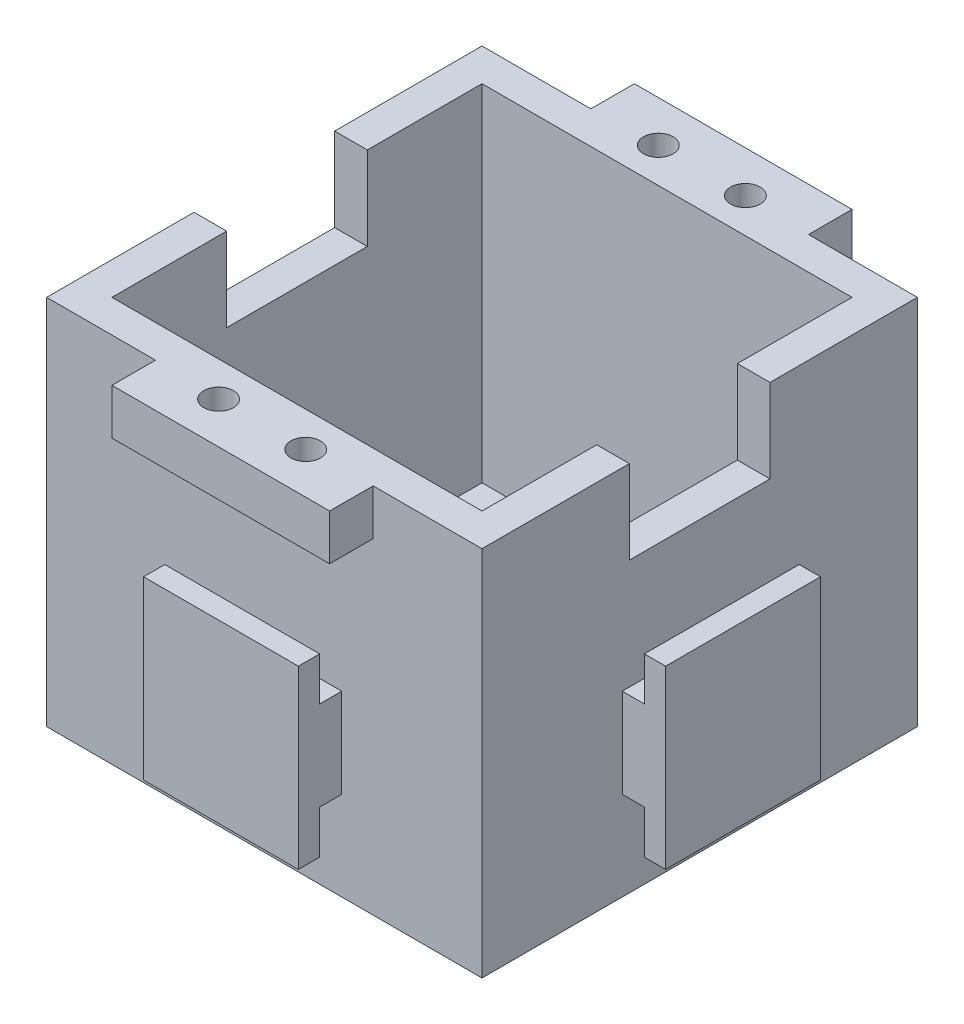
from build123d import *

# Parameters (mm, degrees)
SKETCH1_W                                    = 50
SKETCH1_H                                    = 50
BOSS_EXTRUDE1_DEPTH                          = 3
SKETCH3_W                                    = 50
SKETCH3_H                                    = 50
SKETCH3_W_2                                  = 42.5
SKETCH3_H_2                                  = 42.5
BOSS_EXTRUDE2_DEPTH                          = 39.7
CUT_EXTRUDE5_START                           = -5
SKETCH19_W                                   = 16.15
SKETCH19_H                                   = 9.6
CUT_EXTRUDE5_DEPTH                           = 76.344082907
SKETCH33_W                                   = 25
SKETCH33_H                                   = 5.25
BOSS_EXTRUDE14_DEPTH                         = 5
SKETCH21_R                                   = 1.7
CUT_EXTRUDE6_DEPTH                           = 5
CUT_EXTRUDE8_REACH                           = 59.864
SKETCH27_R                                   = 11.5
CSK_FOR_M3_COUNTERSUNK_FLAT_HEAD_SCR_2_COUNT = 2
CSK_FOR_M3_COUNTERSUNK_FLAT_HEAD_SCR_2_PITCH = 31
CSK_FOR_M3_COUNTERSUNK_FLAT_HEAD_SCR_3_COUNT = 2
CSK_FOR_M3_COUNTERSUNK_FLAT_HEAD_SCR_3_PITCH = 43.840620434
CSK_FOR_M3_COUNTERSUNK_FLAT_HEAD_SCR_4_COUNT = 2
CSK_FOR_M3_COUNTERSUNK_FLAT_HEAD_SCR_4_PITCH = 31
SKETCH34_W                                   = 17.78
SKETCH34_H                                   = 10.2616
BOSS_EXTRUDE15_DEPTH                         = 4.9784
SKETCH35_W                                   = 17.78
SKETCH35_H                                   = 2.4384
BOSS_EXTRUDE16_DEPTH                         = 4.9784
CIRPATTERN1_COUNT                            = 4
CIRPATTERN1_COPY_1_SKETCH_W                  = 17.78
CIRPATTERN1_COPY_1_SKETCH_H                  = 2.4384
CIRPATTERN1_COPY_1_DEPTH                     = 4.9784
CIRPATTERN1_COPY_2_SKETCH_W                  = 17.78
CIRPATTERN1_COPY_2_SKETCH_H                  = 2.4384
CIRPATTERN1_COPY_2_DEPTH                     = 4.9784
CIRPATTERN1_COPY_3_SKETCH_W                  = 17.78
CIRPATTERN1_COPY_3_SKETCH_H                  = 2.4384
CIRPATTERN1_COPY_3_DEPTH                     = 4.9784


with BuildPart() as part:
    # Sketch1 → Boss-Extrude1 (new body)
    with BuildSketch(Plane(origin=(0, 0, 0), x_dir=(1, 0, 0), z_dir=(0, 1, 0))):
        Rectangle(SKETCH1_W, SKETCH1_H)
    extrude(amount=BOSS_EXTRUDE1_DEPTH)

    # Sketch3 → Boss-Extrude2 (add)
    with BuildSketch(Plane(origin=(0, 3, 0), x_dir=(1, 0, 0), z_dir=(0, 1, 0))):
        Rectangle(SKETCH3_W, SKETCH3_H)
        Rectangle(SKETCH3_W_2, SKETCH3_H_2, mode=Mode.SUBTRACT)
    extrude(amount=BOSS_EXTRUDE2_DEPTH)

    # Sketch19 → Cut-Extrude5 (cut)
    with BuildSketch(Plane(origin=(25, 0, 0), x_dir=(0, 0, -1), z_dir=(1, 0, 0)).offset(CUT_EXTRUDE5_START)):
        with Locations((0, 37.9)):
            Rectangle(SKETCH19_W, SKETCH19_H)
    cut_extrude5 = extrude(amount=CUT_EXTRUDE5_DEPTH, mode=Mode.SUBTRACT)

    # Sketch33 → Boss-Extrude14 (add)
    with BuildSketch(Plane.XY.offset(25)):
        with Locations((0, 40.075)):
            Rectangle(SKETCH33_W, SKETCH33_H)
    boss_extrude14 = extrude(amount=BOSS_EXTRUDE14_DEPTH)

    # Mirror7: Boss-Extrude14 across plane
    add(boss_extrude14.mirror(Plane.XY))

    # Sketch21 → Cut-Extrude6 (cut)
    with BuildSketch(Plane(origin=(0, 42.7, 0), x_dir=(1, 0, 0), z_dir=(0, 1, 0))):
        with Locations(Location((5, -25.25, 0), (0, 0, 270))):
            Circle(SKETCH21_R)
        with Locations(Location((-5, 25.25, 0), (0, 0, 270))):
            Circle(SKETCH21_R)
        with Locations(Location((5, 25.25, 0), (0, 0, 270))):
            Circle(SKETCH21_R)
        with Locations(Location((-5, -25.25, 0), (0, 0, 270))):
            Circle(SKETCH21_R)
    extrude(amount=-CUT_EXTRUDE6_DEPTH, mode=Mode.SUBTRACT)

    # Sketch27 → Cut-Extrude8 (cut, up to next)
    with BuildSketch(Plane.XZ, mode=Mode.PRIVATE) as cut_extrude8_sk1:
        with Locations(Location((0, 0, 0), (0, 0, 270))):
            Circle(SKETCH27_R)
    cut_extrude8_tool1 = extrude(cut_extrude8_sk1.sketch, amount=-CUT_EXTRUDE8_REACH, mode=Mode.PRIVATE) & part.part
    add(cut_extrude8_tool1.solids().sort_by_distance((0, 0, 0))[0], mode=Mode.SUBTRACT)

    # Sketch30 → CSK for M3 Countersunk Flat Head Screw1 (revolve, cut)
    with BuildSketch(Plane(origin=(-15.5, 0, 15.5), x_dir=(0, 0, -1), z_dir=(1, 0, 0))):
        Polygon((0, 0), (0, 3), (1.7, 3), (1.7, 1.45), (3.15, 0), align=None)
    csk_for_m3_countersunk_flat_head_screw1 = revolve(axis=Axis((-15.5, -6.35, 15.5), (0, 1, 0)), mode=Mode.SUBTRACT)

    # CSK for M3 Countersunk Flat Head Scr 2: CSK for M3 Countersunk Flat Head Screw1 ×2
    with Locations(*[(i * CSK_FOR_M3_COUNTERSUNK_FLAT_HEAD_SCR_2_PITCH, 0, 0) for i in range(1, CSK_FOR_M3_COUNTERSUNK_FLAT_HEAD_SCR_2_COUNT)]):
        add(csk_for_m3_countersunk_flat_head_screw1, mode=Mode.SUBTRACT)

    # CSK for M3 Countersunk Flat Head Scr 3: CSK for M3 Countersunk Flat Head Screw1 ×2
    with Locations(*[Vector(0.7071067811865475, 0, -0.7071067811865476) * (i * CSK_FOR_M3_COUNTERSUNK_FLAT_HEAD_SCR_3_PITCH) for i in range(1, CSK_FOR_M3_COUNTERSUNK_FLAT_HEAD_SCR_3_COUNT)]):
        add(csk_for_m3_countersunk_flat_head_screw1, mode=Mode.SUBTRACT)

    # CSK for M3 Countersunk Flat Head Scr 4: CSK for M3 Countersunk Flat Head Screw1 ×2
    with Locations(*[(0, 0, -i * CSK_FOR_M3_COUNTERSUNK_FLAT_HEAD_SCR_4_PITCH) for i in range(1, CSK_FOR_M3_COUNTERSUNK_FLAT_HEAD_SCR_4_COUNT)]):
        add(csk_for_m3_countersunk_flat_head_screw1, mode=Mode.SUBTRACT)

    # Mirror4: Cut-Extrude5 across plane
    add(cut_extrude5.mirror(Plane(origin=(0, 0, 0), x_dir=(0, 0, 1), z_dir=(1, 0, 0))), mode=Mode.SUBTRACT)

    # Sketch34 → Boss-Extrude15 (add)
    with BuildSketch(Plane.XY.offset(25)):
        with Locations((0, 15.3416)):
            Rectangle(SKETCH34_W, SKETCH34_H)
    boss_extrude15 = extrude(amount=BOSS_EXTRUDE15_DEPTH)

    # Sketch35 → Boss-Extrude16 (add)
    with BuildSketch(Plane(origin=(0, 20.4724, 0), x_dir=(1, 0, 0), z_dir=(0, 1, 0))):
        with Locations((0, -28.7592)):
            Rectangle(SKETCH35_W, SKETCH35_H)
    boss_extrude16 = extrude(amount=BOSS_EXTRUDE16_DEPTH)

    # Mirror8: Boss-Extrude16 across plane
    add(boss_extrude16.mirror(Plane.ZX.offset(15.3416)))

    # CirPattern1: Boss-Extrude15, Boss-Extrude16 ×4 about axis
    cirpattern1_axis = Axis((0, 0, 0), (0, 1, 0))
    add([boss_extrude15.rotate(cirpattern1_axis, i * 360 / CIRPATTERN1_COUNT) for i in range(1, CIRPATTERN1_COUNT)])
    add([boss_extrude16.rotate(cirpattern1_axis, i * 360 / CIRPATTERN1_COUNT) for i in range(1, CIRPATTERN1_COUNT)])

    # CirPattern1 copy 1 sketch → CirPattern1 copy 1 (add)
    with BuildSketch(Plane(origin=(0, 10.2108, 0), x_dir=(0, 0, -1), z_dir=(0, -1, 0))):
        with Locations((0, 28.7592)):
            Rectangle(CIRPATTERN1_COPY_1_SKETCH_W, CIRPATTERN1_COPY_1_SKETCH_H)
    extrude(amount=CIRPATTERN1_COPY_1_DEPTH)

    # CirPattern1 copy 2 sketch → CirPattern1 copy 2 (add)
    with BuildSketch(Plane(origin=(0, 10.2108, 0), x_dir=(-1, 0, 0), z_dir=(0, -1, 0))):
        with Locations((0, 28.7592)):
            Rectangle(CIRPATTERN1_COPY_2_SKETCH_W, CIRPATTERN1_COPY_2_SKETCH_H)
    extrude(amount=CIRPATTERN1_COPY_2_DEPTH)

    # CirPattern1 copy 3 sketch → CirPattern1 copy 3 (add)
    with BuildSketch(Plane(origin=(0, 10.2108, 0), x_dir=(0, 0, 1), z_dir=(0, -1, 0))):
        with Locations((0, 28.7592)):
            Rectangle(CIRPATTERN1_COPY_3_SKETCH_W, CIRPATTERN1_COPY_3_SKETCH_H)
    extrude(amount=CIRPATTERN1_COPY_3_DEPTH)


solid = part.part
